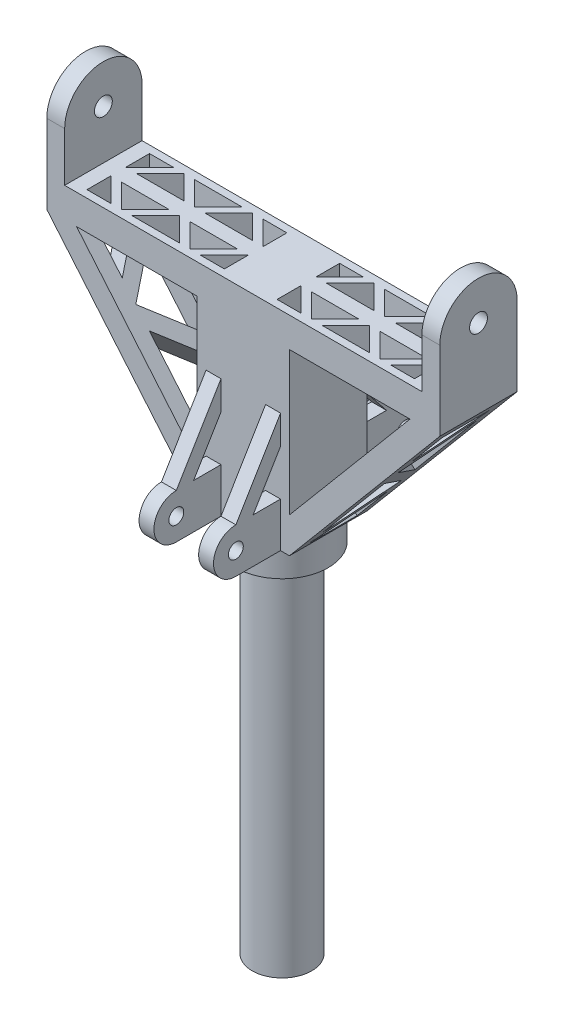
from build123d import *

# Parameters (mm, degrees)
TYKKELSE_LEDDFESTER_OG_BREDDE_H_YDE_SELV_DEPTH = 13
SKETCH28_R                                     = 15.5
SKETCH28_R_2                                   = 10.5
HULL_TIL_L_RBEN_KARBONFIBERR_R_DEPTH           = 10
SKRUEHULL_LEDDFESTER_DEPTH                     = 167.325734629
SKRUEHULL_LEDDFESTER_DEPTH_BACK                = 167.325734629
SKETCH29_R                                     = 3
SKETCH33_W                                     = 5
SKETCH33_H                                     = 20
BREDDE_OG_AVSTAND_STEMPELENDE_DEPTH            = 60
CUT_EXTRUDE4_DEPTH                             = 148.147035308
SIDEM_NSTER_DEPTH                              = 7.650765
SIDEM_NSTER_2_DEPTH                            = 7.650765
UTVIDET_START                                  = -40
SKETCH44_R                                     = 10.5
UTVIDET_L_RBENHULL_INN_I_SELVE_KROPPEN_DEPTH   = 40
M_NSTER_TOPP_DEPTH                             = 10
STEMPELENDE_AV_ST_RSTE_SYLINDER_DEPTH          = 145.150962536
STEMPELENDE_AV_ST_RSTE_SYLINDER_DEPTH_BACK     = 145.150962536
ROD_ENDE_JUSTERE_LENGDEN_ALTS_FESTE_T_R        = 3
SKETCH39_W                                     = 5
SKETCH39_H                                     = 15
SYLINDERFESTE_SELVE_DEN_LILLE_SYLINDERE_DEPTH  = 25
ST_TTER_ST_RSTE_SYLINDER_1_DEPTH               = 5
ST_TTER_ST_RSTE_SYLINDER_2_DEPTH               = 5
SYLINDERFESTE_LITEN_SYLINDER_DEPTH             = 134.515916654
SYLINDERFESTE_LITEN_SYLINDER_DEPTH_BACK        = 134.515916654
SKETCH48_R                                     = 2.5
BOSS_EXTRUDE11_DEPTH                           = 5
BOSS_EXTRUDE12_DEPTH                           = 5
SKETCH51_R                                     = 10
TIL_ASSEMBLY_SLETT_F_R_PRINTING_DEPTH          = 170


with BuildPart() as part:
    # Sketch27 → Tykkelse leddfester og bredde/høyde selve modellen (new, symmetric)
    with BuildSketch(Plane.XY):
        Polygon((66, 0), (-66, 0), (-66, 100), (-60, 100), (-60, 70), (60, 70), (60, 100), (66, 100), align=None)
    extrude(amount=TYKKELSE_LEDDFESTER_OG_BREDDE_H_YDE_SELV_DEPTH, both=True)

    # Sketch28 → Hull til lårben/karbonfiberrør (add)
    with BuildSketch(Plane.XZ):
        with Locations(Location((0, 0, 0), (0, 0, 57.004114526))):
            Circle(SKETCH28_R)
        with Locations(Location((0, 0, 0), (0, 0, 270))):
            Circle(SKETCH28_R_2, mode=Mode.SUBTRACT)
    extrude(amount=HULL_TIL_L_RBEN_KARBONFIBERR_R_DEPTH)

    # Sketch29 → Skruehull leddfester (cut, two sides: drawn at the far end of the back side and taken through both)
    with BuildSketch(Plane(origin=(66, 0, 0), x_dir=(0, 0, -1), z_dir=(1, 0, 0)).offset(-SKRUEHULL_LEDDFESTER_DEPTH_BACK)):
        with Locations((0, 86.5)):
            Circle(SKETCH29_R)
        with BuildLine():
            Line((-13, 86.5), (-13, 71.5))
            Line((-13, 71.5), (-14, 71.5))
            Line((-14, 71.5), (-14, 101))
            Line((-14, 101), (0, 101))
            Line((0, 101), (14, 101))
            Line((14, 101), (14, 71.5))
            Line((14, 71.5), (13, 71.5))
            Line((13, 71.5), (13, 86.5))
            ThreePointArc((13, 86.5), (0, 99.5), (-13, 86.5))
        make_face()
    extrude(amount=SKRUEHULL_LEDDFESTER_DEPTH + SKRUEHULL_LEDDFESTER_DEPTH_BACK, mode=Mode.SUBTRACT)

    # Sketch33 → Bredde og avstand stempelende (add)
    with BuildSketch(Plane(origin=(0, 0, -13), x_dir=(-1, 0, 0), z_dir=(0, 0, -1))):
        with Locations((-6, 10)):
            Rectangle(SKETCH33_W, SKETCH33_H)
        with Locations((6, 10)):
            Rectangle(SKETCH33_W, SKETCH33_H)
    extrude(amount=BREDDE_OG_AVSTAND_STEMPELENDE_DEPTH)

    # Fasong (mønster på selve kroppen) → Cut-Extrude4 (cut, through all)
    with BuildSketch(Plane.XY.offset(13)):
        Polygon((-66, 60), (-15.5, 0), (-66, 0), align=None)
        Polygon((15.5, 0), (66, 0), (66, 60), align=None)
        Polygon((-56, 60), (-15.5, 11.881188119), (-15.5, 60), align=None)
        Polygon((56, 60), (15.5, 60), (15.5, 11.881188119), align=None)
    extrude(amount=-CUT_EXTRUDE4_DEPTH, mode=Mode.SUBTRACT)

    # Sketch40 → Sidemønster (cut)
    with BuildSketch(Plane(origin=(-9.072801919, -7.636274948, 0), x_dir=(0, 0, 1), z_dir=(-0.765076505498557, -0.6439393921279521, 0))):
        Polygon((-8, 81.90459021), (8, 81.90459021), (8, 65.90459021), align=None)
        Polygon((-8, 74.833522398), (8, 58.833522398), (-8, 42.833522398), align=None)
        Polygon((8, 19.762454587), (-8, 35.762454587), (8, 51.762454587), align=None)
        Polygon((-8, 28.691386775), (8, 12.691386775), (-8, 12.691386775), align=None)
    extrude(amount=-SIDEM_NSTER_DEPTH, mode=Mode.SUBTRACT)

    # Sketch42 → Sidemønster 2 (cut)
    with BuildSketch(Plane(origin=(9.072801919, -7.636274948, 0), x_dir=(0, 0, -1), z_dir=(0.765076505498557, -0.6439393921279521, 0))):
        Polygon((8, 81.90459021), (-8, 81.90459021), (-8, 65.90459021), align=None)
        Polygon((8, 74.833522398), (-8, 58.833522398), (8, 42.833522398), align=None)
        Polygon((-8, 51.762454587), (8, 35.762454587), (-8, 19.762454587), align=None)
        Polygon((8, 28.691386775), (-8, 12.691386775), (8, 12.691386775), align=None)
    extrude(amount=-SIDEM_NSTER_2_DEPTH, mode=Mode.SUBTRACT)

    # Sketch44 → Utvidet lårbenhull inn i selve kroppen (cut)
    with BuildSketch(Plane.XZ.offset(UTVIDET_START)):
        with Locations(Location((0, 0, 0), (0, 0, 270))):
            Circle(SKETCH44_R)
    extrude(amount=UTVIDET_L_RBENHULL_INN_I_SELVE_KROPPEN_DEPTH, mode=Mode.SUBTRACT)

    # Sketch45 → Mønster topp (cut)
    with BuildSketch(Plane(origin=(0, 70, 0), x_dir=(1, 0, 0), z_dir=(0, 1, 0))):
        Polygon((-39.928932188, 10.5), (-31.928932188, 2.5), (-23.928932188, 10.5), align=None)
        Polygon((-16.857864376, 10.5), (-8.857864376, 2.5), (-8.857864376, 10.5), align=None)
        Polygon((-55, 2.5), (-55, 10.5), (-47, 10.5), align=None)
        Polygon((-43.464466094, 10.5), (-51.464466094, 2.5), (-35.464466094, 2.5), align=None)
        Polygon((-20.393398282, 10.5), (-28.393398282, 2.5), (-12.393398282, 2.5), align=None)
        Polygon((-8.857864376, -2.5), (-8.857864376, -10.5), (-16.857864376, -10.5), align=None)
        Polygon((-20.393398282, -10.5), (-12.393398282, -2.5), (-28.393398282, -2.5), align=None)
        Polygon((-23.928932188, -10.5), (-31.928932188, -2.5), (-39.928932188, -10.5), align=None)
        Polygon((-43.464466094, -10.5), (-35.464466094, -2.5), (-51.464466094, -2.5), align=None)
        Polygon((-55, -10.5), (-47, -10.5), (-55, -2.5), align=None)
        Polygon((8.857864376, 2.5), (8.857864376, 10.5), (16.857864376, 10.5), align=None)
        Polygon((16.857864376, -10.5), (8.857864376, -2.5), (8.857864376, -10.5), align=None)
        Polygon((20.393398282, -10.5), (28.393398282, -2.5), (12.393398282, -2.5), align=None)
        Polygon((20.393398282, 10.5), (12.393398282, 2.5), (28.393398282, 2.5), align=None)
        Polygon((23.928932188, 10.5), (31.928932188, 2.5), (39.928932188, 10.5), align=None)
        Polygon((23.928932188, -10.5), (39.928932188, -10.5), (31.928932188, -2.5), align=None)
        Polygon((43.464466094, -10.5), (51.464466094, -2.5), (35.464466094, -2.5), align=None)
        Polygon((55, -2.5), (55, -10.5), (47, -10.5), align=None)
        Polygon((43.464466094, 10.5), (35.464466094, 2.5), (51.464466094, 2.5), align=None)
        Polygon((55, 10.5), (47, 10.5), (55, 2.5), align=None)
    extrude(amount=-M_NSTER_TOPP_DEPTH, mode=Mode.SUBTRACT)

    # Rod-ende, justere lengden (altså feste til største sylinder) → Stempelende av st_rste sylinder (cut, two sides: drawn at the far end of the back side and taken through both)
    with BuildSketch(Plane(origin=(8.5, 0, 0), x_dir=(0, 0, -1), z_dir=(1, 0, 0)).offset(-STEMPELENDE_AV_ST_RSTE_SYLINDER_DEPTH_BACK)):
        with Locations((33, 10)):
            Circle(ROD_ENDE_JUSTERE_LENGDEN_ALTS_FESTE_T_R)
        with BuildLine():
            Line((43, -1), (74, -1))
            Line((74, -1), (74, 21))
            Line((74, 21), (43, 21))
            Line((43, 21), (13, 21))
            Line((13, 21), (13, 19))
            Line((13, 19), (33, 19))
            ThreePointArc((33, 19), (42, 10), (33, 1))
            Line((33, 1), (13, 1))
            Line((13, 1), (13, -1))
            Line((13, -1), (43, -1))
        make_face()
    extrude(amount=STEMPELENDE_AV_ST_RSTE_SYLINDER_DEPTH + STEMPELENDE_AV_ST_RSTE_SYLINDER_DEPTH_BACK, mode=Mode.SUBTRACT)

    # Sketch39 → Sylinderfeste_ selve den lille sylindere (add)
    with BuildSketch(Plane.XY.offset(13)):
        with Locations((-10, 7.5)):
            Rectangle(SKETCH39_W, SKETCH39_H)
        with Locations((10, 7.5)):
            Rectangle(SKETCH39_W, SKETCH39_H)
    extrude(amount=SYLINDERFESTE_SELVE_DEN_LILLE_SYLINDERE_DEPTH)

    # Sketch46 → Støtter største sylinder 1 (add)
    with BuildSketch(Plane(origin=(8.5, 0, 0), x_dir=(0, 0, -1), z_dir=(1, 0, 0))):
        Polygon((13, 44), (13, 35.996094703), (26.596875763, 19), (33, 19), align=None)
    extrude(amount=-ST_TTER_ST_RSTE_SYLINDER_1_DEPTH)

    # Sketch47 → Støtter største sylinder 2 (add)
    with BuildSketch(Plane.ZY.offset(8.5)):
        Polygon((-33, 19), (-13, 44), (-13, 35.996094703), (-26.596875763, 19), align=None)
    extrude(amount=-ST_TTER_ST_RSTE_SYLINDER_2_DEPTH)

    # Sketch48 → Sylinderfeste, liten sylinder (cut, two sides: drawn at the far end of the back side and taken through both)
    with BuildSketch(Plane.ZY.offset(12.5).offset(-SYLINDERFESTE_LITEN_SYLINDER_DEPTH_BACK)):
        with Locations(Location((28, 7.5, 0), (0, 0, 270))):
            Circle(SKETCH48_R)
        with BuildLine():
            Line((28, 0), (13.179811187, 0))
            Line((13.179811187, 0), (13.179811187, -1))
            Line((13.179811187, -1), (39, -1))
            Line((39, -1), (39, 16))
            Line((39, 16), (13, 16))
            Line((13, 16), (13, 15))
            Line((13, 15), (28, 15))
            ThreePointArc((28, 15), (35.5, 7.5), (28, 0))
        make_face()
    extrude(amount=SYLINDERFESTE_LITEN_SYLINDER_DEPTH + SYLINDERFESTE_LITEN_SYLINDER_DEPTH_BACK, mode=Mode.SUBTRACT)

    # Sketch49 → Boss-Extrude11 (add)
    with BuildSketch(Plane.ZY.offset(12.5)):
        Polygon((28, 15), (13, 40), (13, 30.281746842), (22.169048105, 15), align=None)
    extrude(amount=-BOSS_EXTRUDE11_DEPTH)

    # Sketch50 → Boss-Extrude12 (add)
    with BuildSketch(Plane(origin=(12.5, 0, 0), x_dir=(0, 0, -1), z_dir=(1, 0, 0))):
        Polygon((-28, 15), (-22.169048105, 15), (-13, 30.281746842), (-13, 40), align=None)
    extrude(amount=-BOSS_EXTRUDE12_DEPTH)

    # Sketch51 → TIL ASSEMBLY - SLETT FØR PRINTING (add)
    with BuildSketch(Plane.XZ.offset(-40)):
        with Locations(Location((0, 0, 0), (0, 0, 270))):
            Circle(SKETCH51_R)
    extrude(amount=TIL_ASSEMBLY_SLETT_F_R_PRINTING_DEPTH)


solid = part.part
